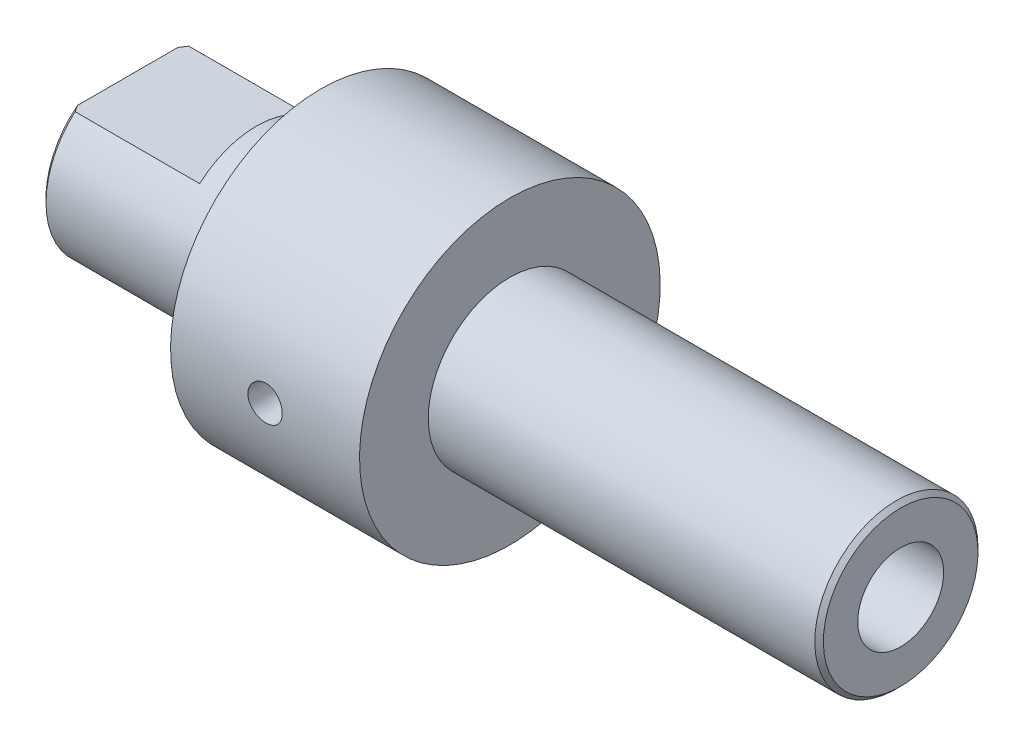
from build123d import *

# Parameters (mm, degrees)
SKETCH_6_R               = 10
CUT_EXTRUDE_4_DEPTH      = 192.154387865
CUT_EXTRUDE_5_DEPTH      = 192.154387865
CUT_EXTRUDE_5_DEPTH_BACK = 192.154387865
SKETCH_2_9_R             = 4
CHAMFER_2_SIZE           = 1
SKETCH_7_W               = 45
SKETCH_7_H               = 12
CUT_EXTRUDE_6_DEPTH      = 30
CUT_EXTRUDE_START        = -14
SKETCH_2_10_W            = 40
SKETCH_2_10_H            = 12
CUT_EXTRUDE_8_DEPTH      = 40


with BuildPart() as part:
    # Эскиз2 → Повернуть3 (revolve)
    with BuildSketch(Plane.XY):
        with BuildLine():
            Line((-15, 19), (0, 19))
            Line((0, 19), (0, 38))
            Line((0, 38), (-90.997222201, 38))
            Line((-90.997222201, 38), (-90.997222201, 54))
            Line((-90.997222201, 54), (-134.997222201, 54))
            Line((-134.997222201, 54), (-134.997222201, 39))
            Line((-134.997222201, 39), (-179.997222201, 39))
            Line((-179.997222201, 39), (-179.997222201, 19))
            Line((-179.997222201, 19), (-116.997222201, 19))
            ThreePointArc((-116.997222201, 19), (-112.997222201, 23), (-108.997222201, 19))
            Line((-108.997222201, 19), (-55, 19))
            Line((-55, 19), (-55, 25))
            Line((-55, 25), (-15, 25))
            Line((-15, 25), (-15, 19))
        make_face()
    revolve(axis=Axis((0, 19, 0), (-1, 0, 0)))

    # Эскиз6 → Вырез-Вытянуть4 (cut, through all)
    with BuildSketch(Plane(origin=(0, 0, 0), x_dir=(0, 0, -1), z_dir=(1, 0, 0))):
        with Locations((0, 19)):
            Circle(SKETCH_6_R)
    extrude(amount=-CUT_EXTRUDE_4_DEPTH, mode=Mode.SUBTRACT)

    # Эскиз2<9> → Вырез-Вытянуть5 (cut, two sides: drawn at the far end of the back side and taken through both)
    with BuildSketch(Plane.XY.offset(-CUT_EXTRUDE_5_DEPTH_BACK)):
        with Locations((-112.997222201, 19)):
            Circle(SKETCH_2_9_R)
    extrude(amount=CUT_EXTRUDE_5_DEPTH + CUT_EXTRUDE_5_DEPTH_BACK, mode=Mode.SUBTRACT)

    # Фаска2
    chamfer_2_edges = [part.edges().sort_by_distance(p)[0] for p in [
        (0, 0, 0),
        (-179.997222201, -1, 0),
    ]]
    chamfer(chamfer_2_edges, length=CHAMFER_2_SIZE)

    # Эскиз7 → Вырез-Вытянуть6 (cut)
    with BuildSketch(Plane.ZY.offset(179.997222201)):
        with Locations((0.22797464, -2)):
            Rectangle(SKETCH_7_W, SKETCH_7_H)
        with Locations((0.22797464, 40)):
            Rectangle(SKETCH_7_W, SKETCH_7_H)
    extrude(amount=-CUT_EXTRUDE_6_DEPTH, mode=Mode.SUBTRACT)

    # Эскиз2<10> → Вырез-Вытянуть8 (cut)
    with BuildSketch(Plane.XY.offset(CUT_EXTRUDE_START)):
        with Locations((-35, 19)):
            Rectangle(SKETCH_2_10_W, SKETCH_2_10_H)
    extrude(amount=-CUT_EXTRUDE_8_DEPTH, mode=Mode.SUBTRACT)


solid = part.part
